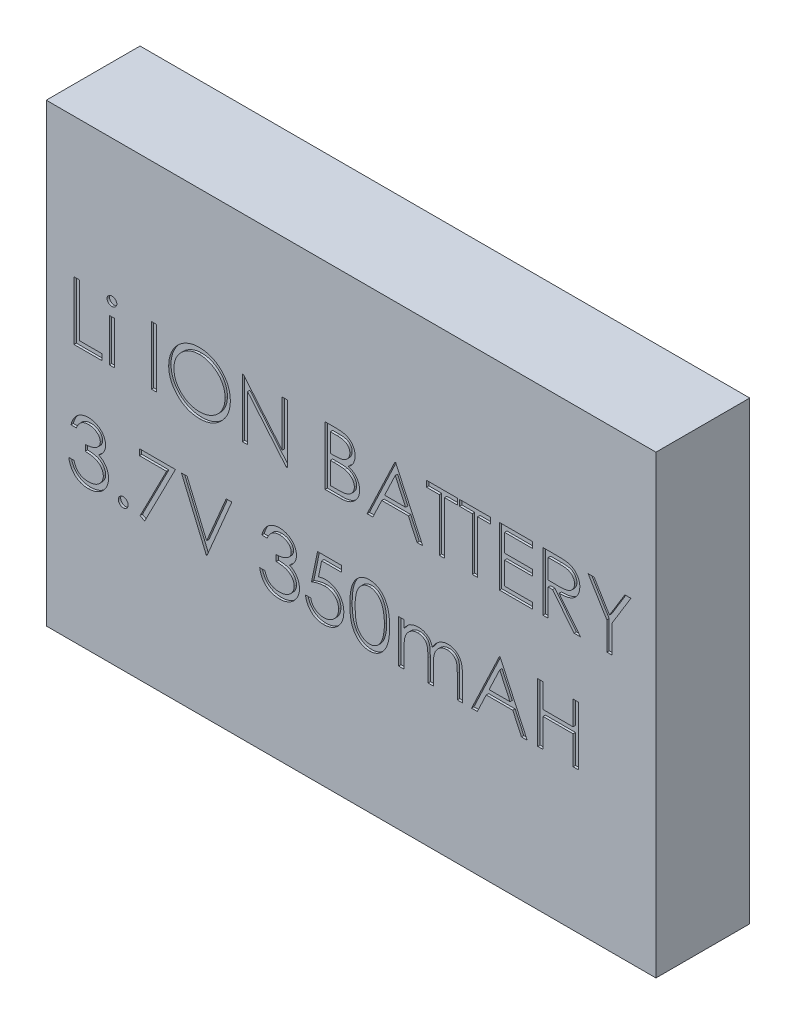
from build123d import *

# Parameters (mm, degrees)
SKETCH1_W           = 33.02
SKETCH1_H           = 24.6634
BOSS_EXTRUDE1_DEPTH = 2.54
SKETCH2_W           = 0.284935898
SKETCH2_H           = 2.320192307
SKETCH2_W_2         = 0.284935897
SKETCH2_H_2         = 3.175
CUT_EXTRUDE1_DEPTH  = 0.127


with BuildPart() as part:
    # Sketch1 → Boss-Extrude1 (new, symmetric)
    with BuildSketch(Plane.XY):
        Rectangle(SKETCH1_W, SKETCH1_H)
    extrude(amount=BOSS_EXTRUDE1_DEPTH, both=True)

    # Sketch2 → Cut-Extrude1 (cut)
    # profile 1 of 23: a face of its own
    with BuildSketch(Plane.XY.offset(2.54)):
        Polygon((-15.007891009, 4.798764989), (-14.722955112, 4.798764989), (-14.722955112, 1.949406014), (-13.501801266, 1.949406014), (-13.501801266, 1.623764989), (-15.007891009, 1.623764989), align=None)
    # profile 2 of 23: a face of its own
    with BuildSketch(Plane.XY.offset(2.54)):
        with BuildLine():
            add(Edge.make_bspline(
                [(-12.95355407, 4.920880373), (-12.935872662, 4.920060178), (-12.90124907, 4.918454078), (-12.851180891, 4.904700452), (-12.805590602, 4.881387166), (-12.76515223, 4.85010917), (-12.730452304, 4.813325032), (-12.706158374, 4.770452582), (-12.690544272, 4.724135102), (-12.688658725, 4.691827129), (-12.687698702, 4.675377569)],
                knots=[0, 0, 0, 0, 1.055194115, 2.066272739, 3.074728998, 4.095836921, 5.109056067, 6.073838105, 7.019297344, 8, 8, 8, 8], degree=3))
            add(Edge.make_bspline(
                [(-12.687698702, 4.675377569), (-12.688680375, 4.659355019), (-12.690621028, 4.627680335), (-12.706146313, 4.582165828), (-12.730659343, 4.539889085), (-12.765129979, 4.503176369), (-12.805596498, 4.471915664), (-12.851179325, 4.448597794), (-12.901249482, 4.434845383), (-12.935872802, 4.433239116), (-12.95355407, 4.432418835)],
                knots=[0, 0, 0, 0, 0.96129708, 1.900370562, 2.859976407, 3.87933698, 4.906634145, 5.921202961, 6.938410037, 8, 8, 8, 8], degree=3))
            add(Edge.make_bspline(
                [(-12.95355407, 4.432418835), (-12.971033148, 4.433207795), (-13.00505389, 4.434743404), (-13.054372383, 4.448867634), (-13.099573941, 4.471923643), (-13.14009118, 4.502971683), (-13.173864284, 4.540114554), (-13.198446336, 4.582140027), (-13.213935766, 4.627686903), (-13.21588125, 4.659357226), (-13.216865368, 4.675377569)],
                knots=[0, 0, 0, 0, 1.054934014, 2.053291228, 3.073705704, 4.106921865, 5.123545215, 6.088680038, 7.033164197, 8, 8, 8, 8], degree=3))
            add(Edge.make_bspline(
                [(-13.216865368, 4.675377569), (-13.215902811, 4.691824839), (-13.214012288, 4.724128317), (-13.198434726, 4.770478811), (-13.174069043, 4.813097745), (-13.140068817, 4.850313734), (-13.099579893, 4.881379235), (-13.054370845, 4.904430625), (-13.005054297, 4.918556055), (-12.971033286, 4.920091498), (-12.95355407, 4.920880373)],
                knots=[0, 0, 0, 0, 0.98631895, 1.937192651, 2.907499808, 3.917963147, 4.944918757, 5.95915025, 6.951458133, 8, 8, 8, 8], degree=3))
        make_face()
    # profile 3 of 23: a face of its own
    with BuildSketch(Plane.XY.offset(2.54)):
        with Locations((-12.952282035, 2.783861143)):
            Rectangle(SKETCH2_W, SKETCH2_H)
    # profile 4 of 23: a face of its own
    with BuildSketch(Plane.XY.offset(2.54)):
        with Locations((-10.672794856, 3.211264989)):
            Rectangle(SKETCH2_W_2, SKETCH2_H_2)
    # profile 5 of 23: a face of its own
    with BuildSketch(Plane.XY.offset(2.54)):
        with BuildLine():
            add(Edge.make_bspline(
                [(-8.230487163, 4.880175245), (-8.171696953, 4.878686189), (-8.056228129, 4.875761559), (-7.886524472, 4.853374087), (-7.724513207, 4.814643269), (-7.568874581, 4.76306042), (-7.421470238, 4.694249656), (-7.281190671, 4.611078129), (-7.14836965, 4.512674484), (-7.024797397, 4.3997994), (-6.911715735, 4.276987267), (-6.812087967, 4.145925163), (-6.728592457, 4.007405535), (-6.66002535, 3.861844638), (-6.60623304, 3.709571668), (-6.569113622, 3.549774822), (-6.545402586, 3.383489468), (-6.542630559, 3.27007224), (-6.541224343, 3.212537024)],
                knots=[0, 0, 0, 0, 1.065120563, 2.091984664, 3.0946048, 4.079830382, 5.057816894, 6.036188127, 7.030412546, 8.04752943, 9.064399622, 10.05169764, 11.02544977, 11.989514704, 12.962713494, 13.945757189, 14.957906945, 16, 16, 16, 16], degree=3))
            add(Edge.make_bspline(
                [(-6.541224343, 3.212537024), (-6.542630353, 3.155425626), (-6.545401762, 3.042852445), (-6.569140582, 2.87762232), (-6.606370632, 2.718790046), (-6.659525816, 2.566620775), (-6.727766071, 2.420953985), (-6.811817548, 2.282172962), (-6.910824218, 2.15023221), (-7.023497575, 2.02657715), (-7.146325664, 1.913186587), (-7.278070263, 1.814381607), (-7.415768489, 1.729360437), (-7.561192295, 1.661520961), (-7.712413043, 1.60729929), (-7.87078415, 1.570330833), (-8.035563524, 1.54648473), (-8.147932221, 1.543746504), (-8.205046458, 1.542354732)],
                knots=[0, 0, 0, 0, 1.043624062, 2.057103931, 3.04512605, 4.022047818, 4.998200453, 5.980619268, 6.982898556, 8.009068085, 9.034988726, 10.034168286, 11.015286542, 11.987931943, 12.962482838, 13.94673481, 14.956375938, 16, 16, 16, 16], degree=3))
            add(Edge.make_bspline(
                [(-8.205046458, 1.542354732), (-8.262581376, 1.543760247), (-8.375998015, 1.546530892), (-8.542492325, 1.570281166), (-8.702401422, 1.607420778), (-8.855268012, 1.660497195), (-9.001177341, 1.729092826), (-9.140414773, 1.812735369), (-9.272421428, 1.911983276), (-9.396102869, 2.024620097), (-9.509268213, 2.147240005), (-9.607928504, 2.278625365), (-9.691589857, 2.416198529), (-9.759955166, 2.560341283), (-9.814079354, 2.710356806), (-9.851004439, 2.867245782), (-9.87489491, 3.030113763), (-9.877647949, 3.141005535), (-9.879044856, 3.197272601)],
                knots=[0, 0, 0, 0, 1.053102029, 2.075944431, 3.073151272, 4.055350789, 5.033113405, 6.020478099, 7.024410459, 8.052272461, 9.079885166, 10.07527673, 11.055994387, 12.023226415, 12.992069828, 13.970394897, 14.97016774, 16, 16, 16, 16], degree=3))
            add(Edge.make_bspline(
                [(-9.879044856, 3.197272601), (-9.878559865, 3.235039379), (-9.877596002, 3.310096491), (-9.865992109, 3.42155405), (-9.849153994, 3.531219147), (-9.825022259, 3.638779935), (-9.793461247, 3.743973114), (-9.756221194, 3.847524163), (-9.710737191, 3.948383684), (-9.659319746, 4.047029475), (-9.601932249, 4.14192379), (-9.538544962, 4.231621697), (-9.471384306, 4.316875887), (-9.397757514, 4.395477098), (-9.320091167, 4.469711915), (-9.237125352, 4.538439522), (-9.149366316, 4.602279656), (-9.056436443, 4.659810966), (-8.96062558, 4.711843895), (-8.861858788, 4.756495146), (-8.76147747, 4.794818359), (-8.659011468, 4.825879679), (-8.554732882, 4.850401597), (-8.44841412, 4.867099696), (-8.340139883, 4.878733185), (-8.26719533, 4.87969249), (-8.230487163, 4.880175245)],
                knots=[0, 0, 0, 0, 1.037015668, 2.060948919, 3.074880161, 4.083647147, 5.086022904, 6.090072063, 7.104153813, 8.122640571, 9.144368836, 10.147691507, 11.138137339, 12.123020368, 13.103399296, 14.087645067, 15.080126199, 16.082011238, 17.087798457, 18.072939717, 19.057185487, 20.037253025, 21.01195951, 21.997135196, 22.992090687, 24, 24, 24, 24], degree=3))
        make_face()
        with BuildLine():
            add(Edge.make_bspline(
                [(-8.216494775, 4.554534219), (-8.246625193, 4.554166926), (-8.306597979, 4.553435851), (-8.395756094, 4.54380588), (-8.483741634, 4.53008091), (-8.57057277, 4.510503387), (-8.65588619, 4.483829711), (-8.740477117, 4.453131173), (-8.823574173, 4.415737755), (-8.90490303, 4.373489659), (-8.983747419, 4.326727423), (-9.058144656, 4.275045892), (-9.12828734, 4.21965706), (-9.194003732, 4.160431665), (-9.255100866, 4.097068098), (-9.312781274, 4.030526959), (-9.364732966, 3.958906315), (-9.412344882, 3.884148303), (-9.454951423, 3.806350297), (-9.492838566, 3.726331351), (-9.523830203, 3.643438735), (-9.549105358, 3.558571749), (-9.570060187, 3.471864804), (-9.583335247, 3.382660141), (-9.59307103, 3.291406003), (-9.593760318, 3.22973675), (-9.594108958, 3.198544636)],
                knots=[0, 0, 0, 0, 1.008559885, 2.007477868, 2.99961109, 3.989939068, 4.984837346, 5.991145699, 7.001802488, 8.033829008, 9.059044045, 10.069351652, 11.065060232, 12.050310815, 13.029377138, 14.011219647, 14.996725999, 15.989392538, 16.977580475, 17.965360261, 18.951710183, 19.937753436, 20.929683414, 21.935841486, 22.955955122, 24, 24, 24, 24], degree=3))
            add(Edge.make_bspline(
                [(-9.594108958, 3.198544636), (-9.592952476, 3.152677479), (-9.590677318, 3.06244259), (-9.570758666, 2.93021006), (-9.540077303, 2.803129972), (-9.494849549, 2.681897668), (-9.438288634, 2.565471069), (-9.368414241, 2.454883002), (-9.285629214, 2.350103581), (-9.191591586, 2.251864301), (-9.088791702, 2.162197036), (-8.979632726, 2.083490229), (-8.865284096, 2.016896645), (-8.745447619, 1.962644901), (-8.620763066, 1.919655639), (-8.490427002, 1.890192881), (-8.355307656, 1.870802289), (-8.263204848, 1.868940146), (-8.216494775, 1.867995758)],
                knots=[0, 0, 0, 0, 1.032063989, 2.030389145, 3.003944642, 3.970395727, 4.937377036, 5.913328081, 6.909231446, 7.93887556, 8.970685674, 9.976071282, 10.964166581, 11.944589148, 12.933237628, 13.927779006, 14.949070134, 16, 16, 16, 16], degree=3))
            add(Edge.make_bspline(
                [(-8.216494775, 1.867995758), (-8.185099013, 1.868427108), (-8.122831787, 1.869282606), (-8.030216564, 1.877899262), (-7.939269857, 1.891716744), (-7.850119232, 1.911610982), (-7.762865867, 1.936509519), (-7.677145582, 1.966089386), (-7.593871418, 2.00299305), (-7.511992851, 2.043767263), (-7.433619118, 2.090249406), (-7.358802027, 2.14017687), (-7.289427389, 2.195484119), (-7.22376016, 2.253829563), (-7.162412185, 2.316389625), (-7.10579832, 2.383082969), (-7.0541092, 2.454330565), (-7.006515364, 2.528975183), (-6.964058118, 2.60698607), (-6.92706565, 2.687295135), (-6.895682031, 2.769704627), (-6.870346887, 2.85433341), (-6.850493647, 2.941020751), (-6.836814005, 3.029882722), (-6.827245064, 3.120741554), (-6.826523816, 3.182194909), (-6.82616024, 3.213173041)],
                knots=[0, 0, 0, 0, 1.047197238, 2.076906641, 3.100256066, 4.114471768, 5.12198147, 6.126382909, 7.136867548, 8.15857795, 9.17633901, 10.174870724, 11.156907918, 12.133735059, 13.104061851, 14.077631395, 15.04955518, 16.038496417, 17.029181396, 18.010275684, 18.986308667, 19.968651475, 20.955262928, 21.950658345, 22.966943676, 24, 24, 24, 24], degree=3))
            add(Edge.make_bspline(
                [(-6.82616024, 3.213173041), (-6.826524107, 3.243939249), (-6.827245904, 3.304969689), (-6.836809434, 3.39519486), (-6.850508099, 3.483417416), (-6.870249984, 3.569291008), (-6.895695481, 3.652837528), (-6.927071131, 3.733978506), (-6.964069224, 3.813016226), (-7.00653097, 3.889755338), (-7.054261038, 3.963392422), (-7.106416531, 4.033788896), (-7.163897954, 4.09962274), (-7.22506299, 4.162519212), (-7.291439436, 4.221136869), (-7.362726617, 4.275495156), (-7.438059097, 4.326905912), (-7.51782166, 4.3732841), (-7.60013939, 4.416114154), (-7.684607051, 4.452808993), (-7.770267735, 4.483989415), (-7.856903608, 4.510584091), (-7.945243881, 4.530004232), (-8.03469164, 4.543818249), (-8.125123132, 4.553432499), (-8.18594091, 4.554165814), (-8.216494775, 4.554534219)],
                knots=[0, 0, 0, 0, 1.02996197, 2.043119294, 3.035359645, 4.018872909, 4.991431989, 5.957985074, 6.929999688, 7.912076566, 8.892894881, 9.867085534, 10.843653904, 11.817741046, 12.803660682, 13.806313499, 14.818574707, 15.856120519, 16.894564902, 17.924820532, 18.937903209, 19.946497019, 20.957711757, 21.963978472, 22.977135795, 24, 24, 24, 24], degree=3))
        make_face(mode=Mode.SUBTRACT)
    # profile 6 of 23: a face of its own
    with BuildSketch(Plane.XY.offset(2.54)):
        Polygon((-5.889942291, 1.623764989), (-5.889942291, 4.798764989), (-5.830156634, 4.798764989), (-3.732570497, 2.299851727), (-3.732570497, 4.798764989), (-3.447634599, 4.798764989), (-3.447634599, 1.623764989), (-3.512508397, 1.623764989), (-5.605006394, 4.116954091), (-5.605006394, 1.623764989), align=None)
    # profile 7 of 23: a face of its own
    with BuildSketch(Plane.XY.offset(2.54)):
        with BuildLine():
            Line((-1.412378189, 4.798764989), (-0.792897019, 4.798764989))
            add(Edge.make_bspline(
                [(-0.792897019, 4.798764989), (-0.762572614, 4.798605558), (-0.703796369, 4.798296541), (-0.618325876, 4.793503987), (-0.538271598, 4.786969229), (-0.463610318, 4.776600502), (-0.394376538, 4.76408939), (-0.33036161, 4.748938457), (-0.271769097, 4.730771457), (-0.201816829, 4.701882331), (-0.122060229, 4.658953457), (-0.035701687, 4.595518258), (0.038143587, 4.517928095), (0.101812603, 4.430404544), (0.15243219, 4.334124236), (0.18905291, 4.231381972), (0.212237554, 4.123502964), (0.214621919, 4.049440938), (0.215826939, 4.012011182)],
                knots=[0, 0, 0, 0, 1.001505555, 1.941167018, 2.826882275, 3.653841531, 4.429895133, 5.150066043, 5.825578002, 6.45369114, 7.647487171, 8.808567382, 9.977351308, 11.170798116, 12.373658725, 13.556498008, 14.765093433, 16, 16, 16, 16], degree=3))
            add(Edge.make_bspline(
                [(0.215826939, 4.012011182), (0.214835234, 3.976947793), (0.21288644, 3.908044925), (0.194251222, 3.807266697), (0.165076902, 3.711335235), (0.124522854, 3.620600642), (0.071816043, 3.537113007), (0.009351711, 3.460198845), (-0.066010817, 3.393114671), (-0.122474327, 3.355610753), (-0.151155232, 3.336560461)],
                knots=[0, 0, 0, 0, 1.044552857, 2.05264487, 3.044412934, 4.028983338, 5.005914585, 5.980388656, 6.974128949, 8, 8, 8, 8], degree=3))
            add(Edge.make_bspline(
                [(-0.151155232, 3.336560461), (-0.115086844, 3.322712927), (-0.046079083, 3.296219162), (0.048886085, 3.24937842), (0.130705694, 3.198431363), (0.20000882, 3.142794613), (0.259279407, 3.082824477), (0.311034575, 3.017641624), (0.355195536, 2.946395751), (0.393035117, 2.869829686), (0.422561488, 2.788725247), (0.444673916, 2.703843186), (0.457344387, 2.615487875), (0.459147462, 2.555357567), (0.460057709, 2.525001968)],
                knots=[0, 0, 0, 0, 1.27268992, 2.434971085, 3.483601985, 4.442670788, 5.356604649, 6.2567628, 7.179492994, 8.113709626, 9.066344395, 10.018646069, 10.999752585, 12, 12, 12, 12], degree=3))
            add(Edge.make_bspline(
                [(0.460057709, 2.525001968), (0.45917157, 2.494007734), (0.457428067, 2.43302571), (0.444564806, 2.343440695), (0.422785117, 2.257829136), (0.392784862, 2.175637292), (0.353630477, 2.09702417), (0.305980109, 2.021900709), (0.249164334, 1.951021709), (0.185607303, 1.883599565), (0.113705213, 1.822977216), (0.036130207, 1.768987967), (-0.048094669, 1.724586897), (-0.13758612, 1.687288791), (-0.233348036, 1.658797976), (-0.334950401, 1.638865712), (-0.442305589, 1.625435429), (-0.515974435, 1.62433125), (-0.553754391, 1.623764989)],
                knots=[0, 0, 0, 0, 0.978564426, 1.925352924, 2.850884081, 3.763762016, 4.682927383, 5.618979971, 6.567305752, 7.547517671, 8.540179244, 9.531824382, 10.526200242, 11.540722885, 12.589160233, 13.674978461, 14.80764778, 16, 16, 16, 16], degree=3))
            Line((-0.553754391, 1.623764989), (-1.412378189, 1.623764989))
            Line((-1.412378189, 1.623764989), (-1.412378189, 4.798764989))
        make_face()
        with BuildLine():
            Line((-1.127442291, 4.473123963), (-1.127442291, 3.455495758))
            Line((-1.127442291, 3.455495758), (-0.936000985, 3.455495758))
            add(Edge.make_bspline(
                [(-0.936000985, 3.455495758), (-0.908016721, 3.455858545), (-0.853945419, 3.456559524), (-0.775640942, 3.4585675), (-0.702956104, 3.464190011), (-0.63601637, 3.469810906), (-0.574927153, 3.478949996), (-0.519823792, 3.489828565), (-0.469841494, 3.501333772), (-0.412202049, 3.520900378), (-0.346821589, 3.549817983), (-0.277122987, 3.594696006), (-0.215678147, 3.648148812), (-0.163792126, 3.709826327), (-0.121327435, 3.777740653), (-0.091832851, 3.85080818), (-0.071832814, 3.927207871), (-0.070026211, 3.979657286), (-0.069108958, 4.006287024)],
                knots=[0, 0, 0, 0, 1.156816544, 2.235205308, 3.236616184, 4.169592532, 5.011045266, 5.787822928, 6.49130361, 7.128639758, 8.301311294, 9.436451833, 10.541879658, 11.654887649, 12.756523258, 13.837046038, 14.901820046, 16, 16, 16, 16], degree=3))
            add(Edge.make_bspline(
                [(-0.069108958, 4.006287024), (-0.069586279, 4.023908974), (-0.070522595, 4.058476353), (-0.078190948, 4.108867553), (-0.091224391, 4.156260099), (-0.107965071, 4.201303471), (-0.131359096, 4.242589221), (-0.158903095, 4.281544834), (-0.192182257, 4.316843684), (-0.230062104, 4.349836015), (-0.273612784, 4.379086408), (-0.322808313, 4.404704815), (-0.378314277, 4.425333948), (-0.439195224, 4.443400743), (-0.506388282, 4.456090124), (-0.579118055, 4.466661411), (-0.657980265, 4.472043256), (-0.712540465, 4.472755692), (-0.740743573, 4.473123963)],
                knots=[0, 0, 0, 0, 0.91205012, 1.789085906, 2.630437955, 3.453916878, 4.269457761, 5.079663411, 5.91843418, 6.774407191, 7.675494373, 8.627863946, 9.638891023, 10.736472738, 11.911756761, 13.175263542, 14.539845004, 16, 16, 16, 16], degree=3))
            Line((-0.740743573, 4.473123963), (-1.127442291, 4.473123963))
        make_face(mode=Mode.SUBTRACT)
        with BuildLine():
            Line((-1.127442291, 3.129854732), (-1.127442291, 1.949406014))
            Line((-1.127442291, 1.949406014), (-0.721663045, 1.949406014))
            add(Edge.make_bspline(
                [(-0.721663045, 1.949406014), (-0.692617305, 1.949754128), (-0.63663547, 1.950425071), (-0.555807926, 1.952615417), (-0.480893253, 1.957597696), (-0.412233301, 1.965440717), (-0.349086676, 1.97394831), (-0.292210903, 1.985388543), (-0.241144935, 1.998495814), (-0.181931813, 2.018756099), (-0.11525363, 2.050230755), (-0.043398067, 2.097687232), (0.020488573, 2.154223375), (0.074740487, 2.219656419), (0.11920227, 2.290804837), (0.151546861, 2.366229547), (0.171495709, 2.444684276), (0.173910677, 2.498175508), (0.175121811, 2.525001968)],
                knots=[0, 0, 0, 0, 1.160039823, 2.235823828, 3.228722157, 4.157150951, 4.99529583, 5.772374946, 6.472645482, 7.099169577, 8.269452708, 9.405989375, 10.527446681, 11.663510218, 12.788923519, 13.866172445, 14.929861265, 16, 16, 16, 16], degree=3))
            add(Edge.make_bspline(
                [(0.175121811, 2.525001968), (0.174871345, 2.541778069), (0.174374453, 2.575059673), (0.166880895, 2.623969023), (0.155982599, 2.671345351), (0.14189337, 2.717317301), (0.121374282, 2.761053721), (0.097419773, 2.803419615), (0.069333359, 2.844470985), (0.025569008, 2.896370672), (-0.038087006, 2.95616682), (-0.128535296, 3.014711554), (-0.231380166, 3.06192635), (-0.305972249, 3.081973733), (-0.344504591, 3.092329692)],
                knots=[0, 0, 0, 0, 0.723448775, 1.435228256, 2.130040452, 2.821711965, 3.505591119, 4.210454504, 4.921174351, 5.648778258, 7.137944449, 8.670945889, 10.280296675, 12, 12, 12, 12], degree=3))
            add(Edge.make_bspline(
                [(-0.344504591, 3.092329692), (-0.359952414, 3.095463947), (-0.39344648, 3.102259658), (-0.448063356, 3.109433074), (-0.510416609, 3.11582395), (-0.580650219, 3.120551214), (-0.658853046, 3.125437579), (-0.745192108, 3.127337881), (-0.839314815, 3.129605067), (-0.904622181, 3.129769382), (-0.938545056, 3.129854732)],
                knots=[0, 0, 0, 0, 0.634451884, 1.375622551, 2.216452059, 3.157844607, 4.20941857, 5.370758133, 6.634282058, 8, 8, 8, 8], degree=3))
            Line((-0.938545056, 3.129854732), (-1.127442291, 3.129854732))
        make_face(mode=Mode.SUBTRACT)
    # profile 8 of 23: a face of its own
    with BuildSketch(Plane.XY.offset(2.54)):
        Polygon((2.413903862, 4.798764989), (3.879288478, 1.623764989), (3.569547893, 1.623764989), (3.100166883, 2.641393194), (1.660858991, 2.641393194), (1.178757628, 1.623764989), (0.867108991, 1.623764989), (2.373198734, 4.798764989), align=None)
        Polygon((2.39037121, 4.179283819), (1.816047292, 2.967034219), (2.950066723, 2.967034219), align=None, mode=Mode.SUBTRACT)
    # profile 9 of 23: a face of its own
    with BuildSketch(Plane.XY.offset(2.54)):
        Polygon((4.082814119, 4.473123963), (4.082814119, 4.798764989), (5.751724375, 4.798764989), (5.751724375, 4.473123963), (5.059737196, 4.473123963), (5.059737196, 1.623764989), (4.774801298, 1.623764989), (4.774801298, 4.473123963), align=None)
    # profile 10 of 23: a face of its own
    with BuildSketch(Plane.XY.offset(2.54)):
        Polygon((5.87383976, 4.473123963), (5.87383976, 4.798764989), (7.542750016, 4.798764989), (7.542750016, 4.473123963), (6.850762837, 4.473123963), (6.850762837, 1.623764989), (6.565826939, 1.623764989), (6.565826939, 4.473123963), align=None)
    # profile 11 of 23: a face of its own
    with BuildSketch(Plane.XY.offset(2.54)):
        Polygon((8.031211555, 4.798764989), (9.822237196, 4.798764989), (9.822237196, 4.473123963), (8.316147452, 4.473123963), (8.316147452, 3.496200886), (9.822237196, 3.496200886), (9.822237196, 3.17055986), (8.316147452, 3.17055986), (8.316147452, 1.949406014), (9.822237196, 1.949406014), (9.822237196, 1.623764989), (8.031211555, 1.623764989), align=None)
    # profile 12 of 23: a face of its own
    with BuildSketch(Plane.XY.offset(2.54)):
        with BuildLine():
            Line((10.392108991, 4.798764989), (11.027490601, 4.798764989))
            add(Edge.make_bspline(
                [(11.027490601, 4.798764989), (11.069891482, 4.79862385), (11.15130587, 4.798352848), (11.267940194, 4.796841763), (11.373919061, 4.79251074), (11.469187058, 4.788783668), (11.553742438, 4.781987407), (11.62784448, 4.775491677), (11.691151891, 4.766988428), (11.729474913, 4.759091365), (11.746826539, 4.75551579)],
                knots=[0, 0, 0, 0, 1.410062039, 2.707475311, 3.878576406, 4.937260626, 5.877586885, 6.699081471, 7.410979367, 8, 8, 8, 8], degree=3))
            add(Edge.make_bspline(
                [(11.746826539, 4.75551579), (11.770055405, 4.74977651), (11.816017602, 4.738420384), (11.882193734, 4.714417746), (11.945253156, 4.686641373), (12.004933925, 4.654017141), (12.060937107, 4.616302876), (12.113840147, 4.574149651), (12.163883103, 4.527788114), (12.209042153, 4.476049365), (12.251622578, 4.421769103), (12.287535118, 4.363073552), (12.31849271, 4.30169488), (12.343140251, 4.237008866), (12.362986698, 4.16964283), (12.376980501, 4.098986564), (12.38537265, 4.025361965), (12.386227047, 3.975144434), (12.386660273, 3.949681455)],
                knots=[0, 0, 0, 0, 1.027469482, 2.033020251, 3.019912614, 3.986113645, 4.951240523, 5.91722682, 6.890402269, 7.87763091, 8.8651537, 9.85103654, 10.82876324, 11.815024772, 12.821070561, 13.842952187, 14.906261191, 16, 16, 16, 16], degree=3))
            add(Edge.make_bspline(
                [(12.386660273, 3.949681455), (12.385327682, 3.907376753), (12.382727451, 3.824829322), (12.358483964, 3.705031237), (12.318772407, 3.59328093), (12.264050566, 3.489719108), (12.194364328, 3.396364451), (12.110612553, 3.314367396), (12.012748519, 3.245751189), (11.921644783, 3.198169002), (11.84116833, 3.167695435), (11.774916682, 3.146253881), (11.702647353, 3.129687669), (11.625052771, 3.114846693), (11.541810026, 3.103641941), (11.453118633, 3.095435388), (11.358915338, 3.090306358), (11.294200611, 3.089542539), (11.260909071, 3.089149604)],
                knots=[0, 0, 0, 0, 1.260483769, 2.459530307, 3.627416485, 4.787058657, 5.939039949, 7.08810263, 8.267026773, 9.491475466, 10.141966685, 10.831826277, 11.566392101, 12.351337768, 13.187381173, 14.07005841, 15.007169909, 16, 16, 16, 16], degree=3))
            Line((11.260909071, 3.089149604), (12.427365401, 1.623764989))
            Line((12.427365401, 1.623764989), (12.075011635, 1.623764989))
            Line((12.075011635, 1.623764989), (10.908555305, 3.089149604))
            Line((10.908555305, 3.089149604), (10.677044888, 3.089149604))
            Line((10.677044888, 3.089149604), (10.677044888, 1.623764989))
            Line((10.677044888, 1.623764989), (10.392108991, 1.623764989))
            Line((10.392108991, 1.623764989), (10.392108991, 4.798764989))
        make_face()
        with BuildLine():
            Line((10.677044888, 4.473123963), (10.677044888, 3.41479063))
            Line((10.677044888, 3.41479063), (11.258365, 3.410338506))
            add(Edge.make_bspline(
                [(11.258365, 3.410338506), (11.28550675, 3.410326499), (11.338115191, 3.410303225), (11.41422508, 3.41392615), (11.485091181, 3.418047589), (11.550442435, 3.424351638), (11.610308035, 3.432476075), (11.66465806, 3.442638782), (11.713581229, 3.454478867), (11.770639188, 3.472804628), (11.834353756, 3.501838659), (11.903597295, 3.544080218), (11.962563701, 3.597210776), (12.012382048, 3.657965268), (12.052413746, 3.724763866), (12.080636824, 3.796805858), (12.09854604, 3.872272522), (12.100658363, 3.924141234), (12.101724375, 3.950317473)],
                knots=[0, 0, 0, 0, 1.146690395, 2.22261258, 3.21895312, 4.145990853, 4.996080663, 5.770904154, 6.481378293, 7.121626537, 8.300444488, 9.431385265, 10.535395872, 11.636531494, 12.74115979, 13.810798291, 14.895190096, 16, 16, 16, 16], degree=3))
            add(Edge.make_bspline(
                [(12.101724375, 3.950317473), (12.10063388, 3.975850436), (12.098472915, 4.026447452), (12.080830104, 4.100521028), (12.050994737, 4.170431761), (12.010788135, 4.235895259), (11.961803187, 4.295318319), (11.904364886, 4.346161093), (11.840043744, 4.388115965), (11.7799263, 4.41492601), (11.726192408, 4.431363306), (11.679538359, 4.442930433), (11.626822947, 4.45222363), (11.567790209, 4.459669513), (11.502692159, 4.466069356), (11.431199639, 4.470379898), (11.353786989, 4.472932475), (11.300132273, 4.473058648), (11.272357388, 4.473123963)],
                knots=[0, 0, 0, 0, 1.101028733, 2.181837193, 3.264309656, 4.369019818, 5.486613113, 6.575447106, 7.666700264, 8.788928104, 9.402425223, 10.0903467, 10.862060571, 11.710948788, 12.657782767, 13.684531032, 14.801375019, 16, 16, 16, 16], degree=3))
            Line((11.272357388, 4.473123963), (10.677044888, 4.473123963))
        make_face(mode=Mode.SUBTRACT)
    # profile 13 of 23: a face of its own
    with BuildSketch(Plane.XY.offset(2.54)):
        Polygon((12.834416683, 4.798764989), (13.160693726, 4.798764989), (13.993876819, 3.435779211), (14.82769593, 4.798764989), (15.154608991, 4.798764989), (14.136980786, 3.13303482), (14.136980786, 1.623764989), (13.852044888, 1.623764989), (13.852044888, 3.13303482), align=None)
    # profile 14 of 23: a face of its own
    with BuildSketch(Plane.XY.offset(2.54)):
        with BuildLine():
            Line((-14.885775625, -2.225593986), (-15.170711522, -2.225593986))
            add(Edge.make_bspline(
                [(-15.170711522, -2.225593986), (-15.162992144, -2.19363309), (-15.147901391, -2.131152152), (-15.116425735, -2.041882708), (-15.082136411, -1.957406371), (-15.040962009, -1.879304932), (-14.996050496, -1.806008785), (-14.944594885, -1.739180365), (-14.888969136, -1.677120032), (-14.827442218, -1.622044452), (-14.762918361, -1.572171798), (-14.694488384, -1.529649424), (-14.623529045, -1.493069657), (-14.549548703, -1.462934161), (-14.472327104, -1.440232436), (-14.392562374, -1.42376162), (-14.310045485, -1.413065395), (-14.254031599, -1.412021488), (-14.225589327, -1.411491422)],
                knots=[0, 0, 0, 0, 1.162005537, 2.271625781, 3.343758855, 4.383309926, 5.390229558, 6.379919256, 7.361854164, 8.333198761, 9.295911338, 10.242430842, 11.177959212, 12.116337295, 13.062827104, 14.020064771, 14.994644689, 16, 16, 16, 16], degree=3))
            add(Edge.make_bspline(
                [(-14.225589327, -1.411491422), (-14.184148554, -1.412742581), (-14.102170951, -1.415217607), (-13.981735901, -1.43781856), (-13.865597287, -1.473582787), (-13.755026326, -1.52299824), (-13.652321034, -1.583946731), (-13.560938921, -1.656486171), (-13.482118629, -1.739216966), (-13.415993015, -1.830595792), (-13.364217838, -1.928254718), (-13.326039485, -2.028766289), (-13.30279696, -2.131892078), (-13.29978474, -2.201521895), (-13.298275625, -2.236406285)],
                knots=[0, 0, 0, 0, 1.083050992, 2.142477498, 3.193116406, 4.255571735, 5.30263384, 6.308962982, 7.297363603, 8.282367274, 9.249857812, 10.179914175, 11.08814088, 12, 12, 12, 12], degree=3))
            add(Edge.make_bspline(
                [(-13.298275625, -2.236406285), (-13.299331168, -2.269976735), (-13.301396703, -2.335668895), (-13.318935135, -2.431573396), (-13.348450174, -2.521962562), (-13.389334887, -2.607216902), (-13.442259008, -2.686795864), (-13.50636924, -2.760878493), (-13.582118083, -2.829793373), (-13.63952112, -2.869271752), (-13.669073902, -2.88959639)],
                knots=[0, 0, 0, 0, 1.024540389, 2.004866551, 2.965041327, 3.920577974, 4.882998113, 5.874504559, 6.905732034, 8, 8, 8, 8], degree=3))
            add(Edge.make_bspline(
                [(-13.669073902, -2.88959639), (-13.635299382, -2.90590516), (-13.568382289, -2.93821755), (-13.477168594, -3.001586701), (-13.394366521, -3.074753531), (-13.348189576, -3.131851509), (-13.324988365, -3.160539899)],
                knots=[0, 0, 0, 0, 1.015518401, 2.012035669, 3.001164323, 4, 4, 4, 4], degree=3))
            add(Edge.make_bspline(
                [(-13.324988365, -3.160539899), (-13.309710862, -3.181456574), (-13.279406035, -3.222947398), (-13.241999515, -3.289655442), (-13.208064104, -3.357102864), (-13.181620691, -3.427097468), (-13.161142969, -3.498827988), (-13.146505282, -3.57241759), (-13.137411954, -3.647926367), (-13.136109704, -3.699009832), (-13.135455112, -3.724687535)],
                knots=[0, 0, 0, 0, 1.025084078, 2.033381695, 3.024893161, 4.013698104, 4.991890475, 5.976764909, 6.982997093, 8, 8, 8, 8], degree=3))
            add(Edge.make_bspline(
                [(-13.135455112, -3.724687535), (-13.137082992, -3.769146354), (-13.140331091, -3.857854767), (-13.169363359, -3.988913979), (-13.214369656, -4.117025684), (-13.278284162, -4.23955786), (-13.356178259, -4.35420292), (-13.448849546, -4.456779286), (-13.555245074, -4.544952306), (-13.673904484, -4.618621584), (-13.802462165, -4.677511413), (-13.93996288, -4.718384951), (-14.084425429, -4.745005965), (-14.183492049, -4.747860624), (-14.233857556, -4.749311935)],
                knots=[0, 0, 0, 0, 0.955779014, 1.907060117, 2.875433937, 3.871313158, 4.872415639, 5.851225146, 6.836215519, 7.83643374, 8.849228613, 9.86973379, 10.916971861, 12, 12, 12, 12], degree=3))
            add(Edge.make_bspline(
                [(-14.233857556, -4.749311935), (-14.267802207, -4.748524341), (-14.334593961, -4.74697462), (-14.432786277, -4.73638046), (-14.526513819, -4.717031098), (-14.615903311, -4.6909931), (-14.701034165, -4.657980591), (-14.781646604, -4.616870058), (-14.858236579, -4.568508909), (-14.930081341, -4.512326298), (-14.997172328, -4.449478225), (-15.057726585, -4.37884898), (-15.112753683, -4.301744193), (-15.160780219, -4.217268277), (-15.203993741, -4.126512937), (-15.239536465, -4.028316085), (-15.270819803, -3.923555579), (-15.285364445, -3.850550772), (-15.292826907, -3.813093986)],
                knots=[0, 0, 0, 0, 1.048658725, 2.063410685, 3.046034179, 4.001477787, 4.936774919, 5.862367409, 6.792675028, 7.730719943, 8.675894397, 9.627829632, 10.600096036, 11.597688215, 12.626045268, 13.701542398, 14.82072376, 16, 16, 16, 16], degree=3))
            Line((-15.292826907, -3.813093986), (-15.007891009, -3.813093986))
            add(Edge.make_bspline(
                [(-15.007891009, -3.813093986), (-15.000467595, -3.837540591), (-14.986028409, -3.885091361), (-14.96145001, -3.953526495), (-14.933448078, -4.016262729), (-14.903408442, -4.073760275), (-14.871859424, -4.126585383), (-14.836558027, -4.173341222), (-14.800118874, -4.216081441), (-14.772651175, -4.240161196), (-14.759208117, -4.251946149)],
                knots=[0, 0, 0, 0, 1.198163088, 2.33053128, 3.407730985, 4.417276592, 5.372219308, 6.28897303, 7.162600585, 8, 8, 8, 8], degree=3))
            add(Edge.make_bspline(
                [(-14.759208117, -4.251946149), (-14.741431222, -4.265651566), (-14.705932307, -4.293020095), (-14.648085411, -4.327946573), (-14.587247979, -4.358209788), (-14.52210181, -4.381327141), (-14.454052697, -4.400901162), (-14.38200073, -4.41371049), (-14.306581583, -4.422499045), (-14.255085112, -4.42327459), (-14.228769415, -4.423670909)],
                knots=[0, 0, 0, 0, 0.946170439, 1.889420265, 2.845303464, 3.807233317, 4.801018734, 5.828864929, 6.890507805, 8, 8, 8, 8], degree=3))
            add(Edge.make_bspline(
                [(-14.228769415, -4.423670909), (-14.199057309, -4.423112195), (-14.140957851, -4.422019678), (-14.056180942, -4.411972429), (-13.975529186, -4.39733984), (-13.899898032, -4.374740206), (-13.828296786, -4.346817576), (-13.761729147, -4.311757951), (-13.699321251, -4.270623811), (-13.641872433, -4.223870431), (-13.590214723, -4.172688075), (-13.544731021, -4.119154789), (-13.506064364, -4.063496287), (-13.474873547, -4.005404563), (-13.450244119, -3.945120176), (-13.433477216, -3.882473953), (-13.421819055, -3.817978575), (-13.420869629, -3.774137296), (-13.420391009, -3.752036293)],
                knots=[0, 0, 0, 0, 1.217147791, 2.380027433, 3.494444702, 4.572153297, 5.609568379, 6.639424714, 7.649109417, 8.668170816, 9.669597737, 10.625200337, 11.543417969, 12.441394052, 13.322311151, 14.205496177, 15.095365482, 16, 16, 16, 16], degree=3))
            add(Edge.make_bspline(
                [(-13.420391009, -3.752036293), (-13.421779211, -3.72245315), (-13.424548708, -3.663434066), (-13.44569292, -3.576604552), (-13.480471746, -3.492944742), (-13.529160382, -3.41388199), (-13.588429221, -3.340606708), (-13.657703101, -3.275227577), (-13.73755728, -3.221279709), (-13.811053875, -3.184006428), (-13.876155124, -3.158572795), (-13.931867651, -3.141631934), (-13.994239713, -3.12728669), (-14.062517044, -3.113940558), (-14.137214104, -3.102581906), (-14.218249573, -3.093109688), (-14.305639871, -3.085530472), (-14.366138286, -3.082145835), (-14.397314086, -3.080401678)],
                knots=[0, 0, 0, 0, 1.07054697, 2.135767047, 3.216561865, 4.33974944, 5.486079747, 6.621378074, 7.775625952, 8.963672916, 9.598146892, 10.304877434, 11.070270905, 11.915000392, 12.823868403, 13.805723172, 14.86925407, 16, 16, 16, 16], degree=3))
            Line((-14.397314086, -3.080401678), (-14.397314086, -2.754760652))
            add(Edge.make_bspline(
                [(-14.397314086, -2.754760652), (-14.358033743, -2.754094081), (-14.2810932, -2.75278843), (-14.168703367, -2.736996878), (-14.061231148, -2.715152308), (-13.961058317, -2.681692169), (-13.869755556, -2.6428299), (-13.790544203, -2.597606824), (-13.724534005, -2.54733773), (-13.672045747, -2.49124672), (-13.632558518, -2.431089499), (-13.603687066, -2.368390816), (-13.586632485, -2.302601132), (-13.584355858, -2.257702398), (-13.583211522, -2.23513425)],
                knots=[0, 0, 0, 0, 1.321986639, 2.589447074, 3.816329219, 5.01088745, 6.139805852, 7.153945165, 8.075214402, 8.924034688, 9.728124013, 10.488707548, 11.240355623, 12, 12, 12, 12], degree=3))
            add(Edge.make_bspline(
                [(-13.583211522, -2.23513425), (-13.583587452, -2.218553724), (-13.584335347, -2.185567554), (-13.593767163, -2.137375528), (-13.6079404, -2.090656812), (-13.627425583, -2.045610085), (-13.653506121, -2.002547765), (-13.684717266, -1.961102722), (-13.721881185, -1.921511579), (-13.764467412, -1.884608718), (-13.810198121, -1.849439481), (-13.86031756, -1.819582111), (-13.913314546, -1.794050519), (-13.969247754, -1.772996185), (-14.0282987, -1.757158116), (-14.090189934, -1.745786317), (-14.155039476, -1.738676445), (-14.199282404, -1.73765281), (-14.221773221, -1.737132447)],
                knots=[0, 0, 0, 0, 0.884392785, 1.759457502, 2.611959086, 3.489218968, 4.37281399, 5.2945488, 6.255912374, 7.266815255, 8.301784654, 9.332968512, 10.37626691, 11.440494194, 12.520033166, 13.637162961, 14.798855837, 16, 16, 16, 16], degree=3))
            add(Edge.make_bspline(
                [(-14.221773221, -1.737132447), (-14.257924377, -1.738394611), (-14.328535993, -1.740859911), (-14.430330953, -1.762452645), (-14.524963492, -1.796904192), (-14.597297853, -1.838027717), (-14.65071276, -1.878622753), (-14.688882554, -1.914076061), (-14.72636616, -1.953475837), (-14.760697595, -1.999248792), (-14.79541756, -2.048295094), (-14.827026555, -2.103108005), (-14.857742133, -2.162257706), (-14.87625016, -2.204073031), (-14.885775625, -2.225593986)],
                knots=[0, 0, 0, 0, 1.472543308, 2.876219568, 4.221790263, 5.565193594, 6.249813518, 6.953379497, 7.687249741, 8.463570142, 9.283606569, 10.136032583, 11.040678096, 12, 12, 12, 12], degree=3))
        make_face()
    # profile 15 of 23: a face of its own
    with BuildSketch(Plane.XY.offset(2.54)):
        with BuildLine():
            add(Edge.make_bspline(
                [(-12.341705112, -4.17944014), (-12.324024705, -4.180490762), (-12.289364335, -4.182550385), (-12.239254554, -4.196680653), (-12.193902256, -4.22177101), (-12.153505148, -4.255210816), (-12.12020713, -4.295756167), (-12.09422261, -4.340746742), (-12.080215431, -4.391276044), (-12.078170811, -4.426137249), (-12.077121779, -4.444023473)],
                knots=[0, 0, 0, 0, 1.020151414, 1.999887582, 2.974338812, 3.990962822, 5.007586832, 5.987933904, 6.967670073, 8, 8, 8, 8], degree=3))
            add(Edge.make_bspline(
                [(-12.077121779, -4.444023473), (-12.078206359, -4.461479922), (-12.080345136, -4.495903783), (-12.094190502, -4.546051967), (-12.120405162, -4.591070659), (-12.153275477, -4.63216617), (-12.193912242, -4.665676817), (-12.239361774, -4.690553709), (-12.289246701, -4.705695719), (-12.32400508, -4.707624574), (-12.341705112, -4.708606806)],
                knots=[0, 0, 0, 0, 1.009421747, 1.99056486, 2.972319754, 3.999869655, 5.017953583, 5.993804169, 6.978383603, 8, 8, 8, 8], degree=3))
            add(Edge.make_bspline(
                [(-12.341705112, -4.708606806), (-12.359417898, -4.707660115), (-12.393997896, -4.705811924), (-12.443696619, -4.690242807), (-12.48942294, -4.665910097), (-12.530051793, -4.632103686), (-12.563197407, -4.591282127), (-12.588257575, -4.545741926), (-12.603307211, -4.496047337), (-12.605286481, -4.461508196), (-12.606288445, -4.444023473)],
                knots=[0, 0, 0, 0, 1.022052826, 1.995314843, 2.982371812, 4.00089066, 5.028879526, 6.005146991, 6.990147033, 8, 8, 8, 8], degree=3))
            add(Edge.make_bspline(
                [(-12.606288445, -4.444023473), (-12.60532497, -4.426107964), (-12.603443901, -4.391130132), (-12.588225981, -4.341056656), (-12.563391846, -4.295546715), (-12.529822666, -4.255272674), (-12.489432769, -4.221538478), (-12.443806926, -4.196986845), (-12.3938782, -4.182435899), (-12.359397756, -4.180456045), (-12.341705112, -4.17944014)],
                knots=[0, 0, 0, 0, 1.032775665, 2.016367738, 2.991239715, 4.008302682, 5.025365648, 6.011011707, 6.979408107, 8, 8, 8, 8], degree=3))
        make_face()
    # profile 16 of 23: a face of its own
    with BuildSketch(Plane.XY.offset(2.54)):
        Polygon((-11.466544856, -1.492901678), (-9.512698702, -1.492901678), (-11.181608958, -4.749311935), (-11.42774778, -4.61384018), (-9.995436081, -1.818542704), (-11.466544856, -1.818542704), align=None)
    # profile 17 of 23: a face of its own
    with BuildSketch(Plane.XY.offset(2.54)):
        Polygon((-9.187057676, -1.492901678), (-8.881769214, -1.492901678), (-7.824071899, -3.993086975), (-6.765738565, -1.492901678), (-6.459814086, -1.492901678), (-7.803083317, -4.667901678), (-7.843788445, -4.667901678), align=None)
    # profile 18 of 23: a face of its own
    with BuildSketch(Plane.XY.offset(2.54)):
        with BuildLine():
            Line((-4.546673061, -2.225593986), (-4.831608958, -2.225593986))
            add(Edge.make_bspline(
                [(-4.831608958, -2.225593986), (-4.82388958, -2.19363309), (-4.808798827, -2.131152152), (-4.777323171, -2.041882708), (-4.743033847, -1.957406371), (-4.701859445, -1.879304932), (-4.656947932, -1.806008785), (-4.60549232, -1.739180365), (-4.549866572, -1.677120032), (-4.488339654, -1.622044452), (-4.423815796, -1.572171798), (-4.35538582, -1.529649424), (-4.284426481, -1.493069657), (-4.210446139, -1.462934161), (-4.13322454, -1.440232436), (-4.05345981, -1.42376162), (-3.970942921, -1.413065395), (-3.914929035, -1.412021488), (-3.886486763, -1.411491422)],
                knots=[0, 0, 0, 0, 1.162005537, 2.271625781, 3.343758855, 4.383309926, 5.390229558, 6.379919256, 7.361854164, 8.333198761, 9.295911338, 10.242430842, 11.177959212, 12.116337295, 13.062827104, 14.020064771, 14.994644689, 16, 16, 16, 16], degree=3))
            add(Edge.make_bspline(
                [(-3.886486763, -1.411491422), (-3.845045989, -1.412742581), (-3.763068387, -1.415217607), (-3.642633337, -1.43781856), (-3.526494722, -1.473582787), (-3.415923762, -1.52299824), (-3.313218469, -1.583946731), (-3.221836357, -1.656486171), (-3.143016065, -1.739216966), (-3.076890451, -1.830595792), (-3.025115274, -1.928254718), (-2.98693692, -2.028766289), (-2.963694396, -2.131892078), (-2.960682176, -2.201521895), (-2.959173061, -2.236406285)],
                knots=[0, 0, 0, 0, 1.083050992, 2.142477498, 3.193116406, 4.255571735, 5.30263384, 6.308962982, 7.297363603, 8.282367274, 9.249857812, 10.179914175, 11.08814088, 12, 12, 12, 12], degree=3))
            add(Edge.make_bspline(
                [(-2.959173061, -2.236406285), (-2.960228604, -2.269976735), (-2.962294138, -2.335668895), (-2.979832571, -2.431573396), (-3.00934761, -2.521962562), (-3.050232323, -2.607216902), (-3.103156444, -2.686795864), (-3.167266676, -2.760878493), (-3.243015519, -2.829793373), (-3.300418556, -2.869271752), (-3.329971338, -2.88959639)],
                knots=[0, 0, 0, 0, 1.024540389, 2.004866551, 2.965041327, 3.920577974, 4.882998113, 5.874504559, 6.905732034, 8, 8, 8, 8], degree=3))
            add(Edge.make_bspline(
                [(-3.329971338, -2.88959639), (-3.296196818, -2.90590516), (-3.229279725, -2.93821755), (-3.13806603, -3.001586701), (-3.055263957, -3.074753531), (-3.009087012, -3.131851509), (-2.985885801, -3.160539899)],
                knots=[0, 0, 0, 0, 1.015518401, 2.012035669, 3.001164323, 4, 4, 4, 4], degree=3))
            add(Edge.make_bspline(
                [(-2.985885801, -3.160539899), (-2.970608298, -3.181456574), (-2.94030347, -3.222947398), (-2.902896951, -3.289655442), (-2.86896154, -3.357102864), (-2.842518126, -3.427097468), (-2.822040404, -3.498827988), (-2.807402718, -3.57241759), (-2.79830939, -3.647926367), (-2.797007139, -3.699009832), (-2.796352548, -3.724687535)],
                knots=[0, 0, 0, 0, 1.025084078, 2.033381695, 3.024893161, 4.013698104, 4.991890475, 5.976764909, 6.982997093, 8, 8, 8, 8], degree=3))
            add(Edge.make_bspline(
                [(-2.796352548, -3.724687535), (-2.797980428, -3.769146354), (-2.801228527, -3.857854767), (-2.830260795, -3.988913979), (-2.875267092, -4.117025684), (-2.939181598, -4.23955786), (-3.017075695, -4.35420292), (-3.109746982, -4.456779286), (-3.21614251, -4.544952306), (-3.33480192, -4.618621584), (-3.463359601, -4.677511413), (-3.600860316, -4.718384951), (-3.745322865, -4.745005965), (-3.844389485, -4.747860624), (-3.894754992, -4.749311935)],
                knots=[0, 0, 0, 0, 0.955779014, 1.907060117, 2.875433937, 3.871313158, 4.872415639, 5.851225146, 6.836215519, 7.83643374, 8.849228613, 9.86973379, 10.916971861, 12, 12, 12, 12], degree=3))
            add(Edge.make_bspline(
                [(-3.894754992, -4.749311935), (-3.928699643, -4.748524341), (-3.995491397, -4.74697462), (-4.093683713, -4.73638046), (-4.187411255, -4.717031098), (-4.276800747, -4.6909931), (-4.361931601, -4.657980591), (-4.44254404, -4.616870058), (-4.519134014, -4.568508909), (-4.590978777, -4.512326298), (-4.658069764, -4.449478225), (-4.718624021, -4.37884898), (-4.773651119, -4.301744193), (-4.821677655, -4.217268277), (-4.864891176, -4.126512937), (-4.900433901, -4.028316085), (-4.931717239, -3.923555579), (-4.946261881, -3.850550772), (-4.953724343, -3.813093986)],
                knots=[0, 0, 0, 0, 1.048658725, 2.063410685, 3.046034179, 4.001477787, 4.936774919, 5.862367409, 6.792675028, 7.730719943, 8.675894397, 9.627829632, 10.600096036, 11.597688215, 12.626045268, 13.701542398, 14.82072376, 16, 16, 16, 16], degree=3))
            Line((-4.953724343, -3.813093986), (-4.668788445, -3.813093986))
            add(Edge.make_bspline(
                [(-4.668788445, -3.813093986), (-4.661365031, -3.837540591), (-4.646925845, -3.885091361), (-4.622347446, -3.953526495), (-4.594345514, -4.016262729), (-4.564305878, -4.073760275), (-4.532756859, -4.126585383), (-4.497455463, -4.173341222), (-4.46101631, -4.216081441), (-4.433548611, -4.240161196), (-4.420105553, -4.251946149)],
                knots=[0, 0, 0, 0, 1.198163088, 2.33053128, 3.407730985, 4.417276592, 5.372219308, 6.28897303, 7.162600585, 8, 8, 8, 8], degree=3))
            add(Edge.make_bspline(
                [(-4.420105553, -4.251946149), (-4.402328658, -4.265651566), (-4.366829743, -4.293020095), (-4.308982847, -4.327946573), (-4.248145415, -4.358209788), (-4.182999246, -4.381327141), (-4.114950133, -4.400901162), (-4.042898166, -4.41371049), (-3.967479019, -4.422499045), (-3.915982548, -4.42327459), (-3.889666851, -4.423670909)],
                knots=[0, 0, 0, 0, 0.946170439, 1.889420265, 2.845303464, 3.807233317, 4.801018734, 5.828864929, 6.890507805, 8, 8, 8, 8], degree=3))
            add(Edge.make_bspline(
                [(-3.889666851, -4.423670909), (-3.859954745, -4.423112195), (-3.801855286, -4.422019678), (-3.717078378, -4.411972429), (-3.636426622, -4.39733984), (-3.560795468, -4.374740206), (-3.489194222, -4.346817576), (-3.422626583, -4.311757951), (-3.360218687, -4.270623811), (-3.302769869, -4.223870431), (-3.251112159, -4.172688075), (-3.205628457, -4.119154789), (-3.1669618, -4.063496287), (-3.135770983, -4.005404563), (-3.111141555, -3.945120176), (-3.094374652, -3.882473953), (-3.082716491, -3.817978575), (-3.081767065, -3.774137296), (-3.081288445, -3.752036293)],
                knots=[0, 0, 0, 0, 1.217147791, 2.380027433, 3.494444702, 4.572153297, 5.609568379, 6.639424714, 7.649109417, 8.668170816, 9.669597737, 10.625200337, 11.543417969, 12.441394052, 13.322311151, 14.205496177, 15.095365482, 16, 16, 16, 16], degree=3))
            add(Edge.make_bspline(
                [(-3.081288445, -3.752036293), (-3.082676647, -3.72245315), (-3.085446144, -3.663434066), (-3.106590355, -3.576604552), (-3.141369182, -3.492944742), (-3.190057817, -3.41388199), (-3.249326657, -3.340606708), (-3.318600537, -3.275227577), (-3.398454715, -3.221279709), (-3.471951311, -3.184006428), (-3.53705256, -3.158572795), (-3.592765087, -3.141631934), (-3.655137149, -3.12728669), (-3.72341448, -3.113940558), (-3.79811154, -3.102581906), (-3.879147009, -3.093109688), (-3.966537307, -3.085530472), (-4.027035722, -3.082145835), (-4.058211522, -3.080401678)],
                knots=[0, 0, 0, 0, 1.07054697, 2.135767047, 3.216561865, 4.33974944, 5.486079747, 6.621378074, 7.775625952, 8.963672916, 9.598146892, 10.304877434, 11.070270905, 11.915000392, 12.823868403, 13.805723172, 14.86925407, 16, 16, 16, 16], degree=3))
            Line((-4.058211522, -3.080401678), (-4.058211522, -2.754760652))
            add(Edge.make_bspline(
                [(-4.058211522, -2.754760652), (-4.018931179, -2.754094081), (-3.941990636, -2.75278843), (-3.829600802, -2.736996878), (-3.722128584, -2.715152308), (-3.621955753, -2.681692169), (-3.530652992, -2.6428299), (-3.451441639, -2.597606824), (-3.385431441, -2.54733773), (-3.332943183, -2.49124672), (-3.293455954, -2.431089499), (-3.264584502, -2.368390816), (-3.247529921, -2.302601132), (-3.245253294, -2.257702398), (-3.244108958, -2.23513425)],
                knots=[0, 0, 0, 0, 1.321986639, 2.589447074, 3.816329219, 5.01088745, 6.139805852, 7.153945165, 8.075214402, 8.924034688, 9.728124013, 10.488707548, 11.240355623, 12, 12, 12, 12], degree=3))
            add(Edge.make_bspline(
                [(-3.244108958, -2.23513425), (-3.244484888, -2.218553724), (-3.245232783, -2.185567554), (-3.254664599, -2.137375528), (-3.268837836, -2.090656812), (-3.288323019, -2.045610085), (-3.314403557, -2.002547765), (-3.345614702, -1.961102722), (-3.382778621, -1.921511579), (-3.425364848, -1.884608718), (-3.471095557, -1.849439481), (-3.521214996, -1.819582111), (-3.574211982, -1.794050519), (-3.63014519, -1.772996185), (-3.689196136, -1.757158116), (-3.75108737, -1.745786317), (-3.815936912, -1.738676445), (-3.86017984, -1.73765281), (-3.882670657, -1.737132447)],
                knots=[0, 0, 0, 0, 0.884392785, 1.759457502, 2.611959086, 3.489218968, 4.37281399, 5.2945488, 6.255912374, 7.266815255, 8.301784654, 9.332968512, 10.37626691, 11.440494194, 12.520033166, 13.637162961, 14.798855837, 16, 16, 16, 16], degree=3))
            add(Edge.make_bspline(
                [(-3.882670657, -1.737132447), (-3.918821813, -1.738394611), (-3.989433429, -1.740859911), (-4.091228389, -1.762452645), (-4.185860928, -1.796904192), (-4.258195289, -1.838027717), (-4.311610196, -1.878622753), (-4.34977999, -1.914076061), (-4.387263596, -1.953475837), (-4.421595031, -1.999248792), (-4.456314996, -2.048295094), (-4.487923991, -2.103108005), (-4.518639569, -2.162257706), (-4.537147596, -2.204073031), (-4.546673061, -2.225593986)],
                knots=[0, 0, 0, 0, 1.472543308, 2.876219568, 4.221790263, 5.565193594, 6.249813518, 6.953379497, 7.687249741, 8.463570142, 9.283606569, 10.136032583, 11.040678096, 12, 12, 12, 12], degree=3))
        make_face()
    # profile 19 of 23: a face of its own
    with BuildSketch(Plane.XY.offset(2.54)):
        with BuildLine():
            Line((-0.516865368, -1.492901678), (-0.516865368, -1.818542704))
            Line((-0.516865368, -1.818542704), (-1.596187283, -1.818542704))
            Line((-1.596187283, -1.818542704), (-1.767912043, -2.65363385))
            add(Edge.make_bspline(
                [(-1.767912043, -2.65363385), (-1.734297071, -2.644353532), (-1.66917338, -2.626374383), (-1.573052649, -2.606412006), (-1.48180115, -2.594378353), (-1.422587064, -2.592735236), (-1.393933678, -2.59194014)],
                knots=[0, 0, 0, 0, 1.100273476, 2.13160584, 3.095893838, 4, 4, 4, 4], degree=3))
            add(Edge.make_bspline(
                [(-1.393933678, -2.59194014), (-1.358479142, -2.592707524), (-1.288766668, -2.594216394), (-1.18676848, -2.608705143), (-1.089402213, -2.631510637), (-0.996871491, -2.663369967), (-0.909005134, -2.704109511), (-0.826611561, -2.755000171), (-0.748454025, -2.814448265), (-0.675934672, -2.882796954), (-0.610144764, -2.958018706), (-0.552299902, -3.038897632), (-0.503166695, -3.124647726), (-0.463650868, -3.216088278), (-0.432096507, -3.312208367), (-0.41109434, -3.414019353), (-0.397109183, -3.520561576), (-0.395546733, -3.593409293), (-0.394749984, -3.630556927)],
                knots=[0, 0, 0, 0, 1.052922333, 2.070308379, 3.05430497, 4.020497103, 4.973039431, 5.925935799, 6.892292201, 7.88610001, 8.88166317, 9.857072816, 10.836096531, 11.812156883, 12.81219415, 13.836441305, 14.89672472, 16, 16, 16, 16], degree=3))
            add(Edge.make_bspline(
                [(-0.394749984, -3.630556927), (-0.395353302, -3.656430655), (-0.396551785, -3.707828451), (-0.402646504, -3.784159261), (-0.414381046, -3.858874117), (-0.430136053, -3.93198293), (-0.450585247, -4.003347289), (-0.475340317, -4.073171461), (-0.505635285, -4.141020854), (-0.538865175, -4.207537462), (-0.576281623, -4.271217537), (-0.617809269, -4.330770546), (-0.661683679, -4.387089858), (-0.70889265, -4.439571459), (-0.759874981, -4.487870482), (-0.814013237, -4.532273566), (-0.870875418, -4.57353163), (-0.931341245, -4.609969922), (-0.994063354, -4.643500603), (-1.059947523, -4.671008383), (-1.127494015, -4.695601505), (-1.19767501, -4.715204434), (-1.27033154, -4.73056468), (-1.345583372, -4.740997368), (-1.423035837, -4.748595993), (-1.475536741, -4.74907166), (-1.502056674, -4.749311935)],
                knots=[0, 0, 0, 0, 1.056347294, 2.098418968, 3.122841568, 4.141288669, 5.149314143, 6.15115421, 7.162517403, 8.180376062, 9.185164535, 10.17417709, 11.141909838, 12.097768115, 13.052685741, 14.0056014, 14.954263652, 15.917497458, 16.885230207, 17.854509472, 18.828990115, 19.81800267, 20.826176721, 21.857883937, 22.917946725, 24, 24, 24, 24], degree=3))
            add(Edge.make_bspline(
                [(-1.502056674, -4.749311935), (-1.533692538, -4.748685246), (-1.595932363, -4.74745231), (-1.687118878, -4.734554112), (-1.774852842, -4.716081131), (-1.858428005, -4.688289658), (-1.938593365, -4.653466898), (-2.014269688, -4.609455799), (-2.087390642, -4.559581898), (-2.154983704, -4.500726149), (-2.217718178, -4.436395495), (-2.273876225, -4.36658392), (-2.323890256, -4.292443641), (-2.366959355, -4.213614601), (-2.403696846, -4.130303933), (-2.432557585, -4.042199497), (-2.455851521, -3.949761636), (-2.465706196, -3.88612238), (-2.470711522, -3.853799114)],
                knots=[0, 0, 0, 0, 1.0467383, 2.05933395, 3.04377827, 4.011590433, 4.970194871, 5.932262533, 6.905835911, 7.896367577, 8.894135286, 9.877477877, 10.858688626, 11.851381753, 12.8477658, 13.868841284, 14.917554742, 16, 16, 16, 16], degree=3))
            Line((-2.470711522, -3.853799114), (-2.185775625, -3.853799114))
            add(Edge.make_bspline(
                [(-2.185775625, -3.853799114), (-2.178764719, -3.884076324), (-2.165289369, -3.942270804), (-2.135711297, -4.024032807), (-2.099547253, -4.096893817), (-2.056544737, -4.161817653), (-2.005245781, -4.218431529), (-1.94670837, -4.268884149), (-1.88107865, -4.31440016), (-1.808150506, -4.352339384), (-1.731212927, -4.384696039), (-1.650688386, -4.406242219), (-1.568769443, -4.421392315), (-1.513362636, -4.422908841), (-1.485520216, -4.423670909)],
                knots=[0, 0, 0, 0, 1.136247022, 2.183929868, 3.172523383, 4.106158343, 5.02341133, 5.958108904, 6.928429099, 7.938127109, 8.96079061, 9.975095812, 10.982467395, 12, 12, 12, 12], degree=3))
            add(Edge.make_bspline(
                [(-1.485520216, -4.423670909), (-1.458343627, -4.422926346), (-1.404832701, -4.421460296), (-1.326082372, -4.410176335), (-1.250052122, -4.392797681), (-1.177492163, -4.366790027), (-1.107132766, -4.335180889), (-1.040753703, -4.294617928), (-0.976434664, -4.247936339), (-0.916174857, -4.194454254), (-0.860984786, -4.135517459), (-0.812220304, -4.072491538), (-0.771601247, -4.00525697), (-0.73737102, -3.934977753), (-0.711378384, -3.860883633), (-0.692835494, -3.783321853), (-0.681947005, -3.702100835), (-0.680449149, -3.646702247), (-0.679685881, -3.618472592)],
                knots=[0, 0, 0, 0, 1.027316725, 2.022795036, 3.002884548, 3.971462791, 4.93288096, 5.914575861, 6.907176829, 7.935150275, 8.956128384, 9.956726525, 10.942570165, 11.921478529, 12.907843606, 13.90538589, 14.932640048, 16, 16, 16, 16], degree=3))
            add(Edge.make_bspline(
                [(-0.679685881, -3.618472592), (-0.680283216, -3.593003874), (-0.681452414, -3.543152483), (-0.691005146, -3.470218917), (-0.707621257, -3.4012098), (-0.730684348, -3.335791888), (-0.759966472, -3.27390348), (-0.795749913, -3.215480704), (-0.83870621, -3.161293584), (-0.88777528, -3.111316767), (-0.941530789, -3.065193202), (-1.000897612, -3.025873924), (-1.064633403, -2.992795941), (-1.131970254, -2.964249971), (-1.20450984, -2.943747867), (-1.280815643, -2.92835557), (-1.361711656, -2.919451634), (-1.417020781, -2.918216207), (-1.445451106, -2.917581165)],
                knots=[0, 0, 0, 0, 1.045622112, 2.046656509, 3.013763289, 3.955457236, 4.890082067, 5.820317437, 6.762574623, 7.722996705, 8.69280354, 9.665887285, 10.63943826, 11.638615906, 12.663482002, 13.728887084, 14.832589034, 16, 16, 16, 16], degree=3))
            add(Edge.make_bspline(
                [(-1.445451106, -2.917581165), (-1.47006092, -2.918107844), (-1.520873942, -2.919195303), (-1.59881822, -2.927202197), (-1.680725712, -2.940119271), (-1.766282433, -2.957886795), (-1.855745322, -2.981137844), (-1.948925586, -3.009000283), (-2.046019142, -3.042312382), (-2.111440221, -3.067469462), (-2.145070497, -3.080401678)],
                knots=[0, 0, 0, 0, 0.817624296, 1.688186739, 2.600797293, 3.572016777, 4.590301741, 5.671205678, 6.80286297, 8, 8, 8, 8], degree=3))
            Line((-2.145070497, -3.080401678), (-1.819429471, -1.492901678))
            Line((-1.819429471, -1.492901678), (-0.516865368, -1.492901678))
        make_face()
    # profile 20 of 23: a face of its own
    with BuildSketch(Plane.XY.offset(2.54)):
        with BuildLine():
            add(Edge.make_bspline(
                [(-0.069108958, -3.081673713), (-0.068811399, -3.030785369), (-0.068233385, -2.931934026), (-0.061803175, -2.787893672), (-0.051121257, -2.65276541), (-0.036482355, -2.526542771), (-0.018667901, -2.409193171), (0.00511329, -2.301030212), (0.032157761, -2.201553284), (0.063501765, -2.110437997), (0.09886926, -2.026456795), (0.137363196, -1.948056791), (0.18051126, -1.875356609), (0.225847459, -1.807195899), (0.275206981, -1.744690405), (0.32718517, -1.686957418), (0.383810729, -1.635331237), (0.443158744, -1.588299234), (0.505766536, -1.547070071), (0.569849526, -1.510754658), (0.635848801, -1.479730493), (0.703944553, -1.455337026), (0.77352473, -1.435188615), (0.844832569, -1.421410069), (0.917985807, -1.412740588), (0.967362894, -1.411911761), (0.992404463, -1.411491422)],
                knots=[0, 0, 0, 0, 1.646270934, 3.197905019, 4.663502075, 6.030701355, 7.308322542, 8.50163776, 9.611534131, 10.641858119, 11.616356847, 12.558055219, 13.465016945, 14.349605745, 15.204443733, 16.039544428, 16.859896111, 17.680448484, 18.487036065, 19.28249412, 20.06191084, 20.843045899, 21.620316918, 22.403196591, 23.190181807, 24, 24, 24, 24], degree=3))
            add(Edge.make_bspline(
                [(0.992404463, -1.411491422), (1.017655219, -1.41193394), (1.067871027, -1.412813969), (1.142111939, -1.421272117), (1.214637721, -1.435306636), (1.285139176, -1.455192091), (1.354195414, -1.479862455), (1.421266298, -1.51078434), (1.486768436, -1.546778741), (1.549660911, -1.589073258), (1.610634169, -1.636228609), (1.668190536, -1.689534744), (1.722335249, -1.748453418), (1.773747848, -1.812354252), (1.820969711, -1.882462864), (1.865939896, -1.957559878), (1.906191671, -2.038958591), (1.944958127, -2.125300873), (1.978419893, -2.218975763), (2.00859713, -2.319455225), (2.032980194, -2.427926094), (2.053290463, -2.543819259), (2.069024761, -2.667560333), (2.080484372, -2.798884063), (2.086537814, -2.937876845), (2.087677821, -3.03290718), (2.088262837, -3.081673713)],
                knots=[0, 0, 0, 0, 0.810914788, 1.612654377, 2.396697861, 3.181598691, 3.963628158, 4.749916497, 5.551656086, 6.361998678, 7.18212741, 8.025565596, 8.878627764, 9.750805457, 10.657531673, 11.591944965, 12.560506719, 13.57287815, 14.630710178, 15.753379473, 16.941251878, 18.199788006, 19.531962791, 20.947069417, 22.433333509, 24, 24, 24, 24], degree=3))
            add(Edge.make_bspline(
                [(2.088262837, -3.081673713), (2.087671757, -3.130227544), (2.086520061, -3.224832703), (2.080552234, -3.363200088), (2.068796904, -3.493826884), (2.054092129, -3.617026375), (2.033725898, -3.732285787), (2.008684069, -3.840003965), (1.980879848, -3.940646087), (1.946558284, -4.033387666), (1.908992854, -4.119522443), (1.868121355, -4.199956214), (1.824333727, -4.275399922), (1.776628222, -4.345249693), (1.725779769, -4.410000331), (1.670700061, -4.468508889), (1.612941744, -4.522185142), (1.551789053, -4.569947689), (1.487915717, -4.611753191), (1.422638554, -4.649140041), (1.354799342, -4.679286843), (1.285935449, -4.705172201), (1.21506186, -4.724948325), (1.14226692, -4.738622466), (1.067920906, -4.748212643), (1.017663772, -4.748944235), (0.992404463, -4.749311935)],
                knots=[0, 0, 0, 0, 1.561518951, 3.042555995, 4.452378317, 5.7783523, 7.031515105, 8.214008947, 9.334062868, 10.386615937, 11.391082383, 12.354592575, 13.286541444, 14.194233754, 15.072674879, 15.931287219, 16.775624067, 17.606195743, 18.42308326, 19.229000347, 20.022332153, 20.807536673, 21.593273796, 22.3848459, 23.188221202, 24, 24, 24, 24], degree=3))
            add(Edge.make_bspline(
                [(0.992404463, -4.749311935), (0.967363589, -4.748888883), (0.917987871, -4.748054709), (0.844824599, -4.739424396), (0.77381124, -4.725549189), (0.70459737, -4.70612127), (0.636827889, -4.682340668), (0.571426257, -4.651358398), (0.507665287, -4.615676779), (0.44571509, -4.575040932), (0.386739772, -4.528484834), (0.330407466, -4.476991515), (0.278133342, -4.419275992), (0.229479555, -4.35624959), (0.183238775, -4.288492149), (0.140703415, -4.215078553), (0.101359854, -4.136299899), (0.065397545, -4.051647223), (0.033512686, -3.959885253), (0.005347979, -3.859964212), (-0.016889864, -3.751002171), (-0.035924402, -3.633874274), (-0.051277235, -3.508077208), (-0.061758659, -3.373542681), (-0.068236851, -3.230354527), (-0.068812951, -3.132138375), (-0.069108958, -3.081673713)],
                knots=[0, 0, 0, 0, 0.810891512, 1.598919785, 2.382837074, 3.152667961, 3.926044502, 4.706494248, 5.493654104, 6.291793342, 7.103789334, 7.925228297, 8.761435821, 9.622817696, 10.50288917, 11.416980706, 12.369136599, 13.353924996, 14.394355917, 15.514179734, 16.714354668, 17.994756427, 19.357759367, 20.818452758, 22.365282078, 24, 24, 24, 24], degree=3))
        make_face()
        with BuildLine():
            add(Edge.make_bspline(
                [(0.215826939, -3.080401678), (0.215935295, -3.122809426), (0.216145592, -3.205114538), (0.221639431, -3.324715211), (0.22912357, -3.436266866), (0.238776747, -3.539911146), (0.253112278, -3.635297229), (0.269174865, -3.723081155), (0.28872206, -3.802798363), (0.311849684, -3.874995877), (0.338192293, -3.940898961), (0.366954041, -4.00222292), (0.397851982, -4.059692177), (0.432431497, -4.112790522), (0.47009159, -4.161691113), (0.509981618, -4.207259468), (0.55359032, -4.24789673), (0.613918715, -4.296634663), (0.693562659, -4.346998448), (0.793911215, -4.390855258), (0.897024739, -4.418416487), (0.967011944, -4.421921465), (1.001944728, -4.423670909)],
                knots=[0, 0, 0, 0, 1.459021318, 2.831673884, 4.118529203, 5.306027144, 6.411944654, 7.436330062, 8.375795394, 9.233974572, 10.042671642, 10.816086306, 11.563610507, 12.285937304, 12.993564865, 13.685989202, 14.367179055, 15.041617293, 16.353048772, 17.594441528, 18.799311195, 20, 20, 20, 20], degree=3))
            add(Edge.make_bspline(
                [(1.001944728, -4.423670909), (1.037103473, -4.422221493), (1.107348373, -4.419325655), (1.209976887, -4.3913868), (1.309608632, -4.34923229), (1.387688178, -4.299387053), (1.4470902, -4.251917782), (1.489650612, -4.211445923), (1.528714042, -4.166128815), (1.565763638, -4.117234453), (1.599744371, -4.0638287), (1.630644503, -4.006168364), (1.65884154, -3.944093324), (1.674906175, -3.900759346), (1.683119608, -3.878603802)],
                knots=[0, 0, 0, 0, 1.353760809, 2.704726607, 4.075137775, 5.516104923, 6.260822281, 7.007110065, 7.778089737, 8.566572457, 9.372053459, 10.217411131, 11.088608312, 12, 12, 12, 12], degree=3))
            add(Edge.make_bspline(
                [(1.683119608, -3.878603802), (1.692691568, -3.850273966), (1.712126754, -3.792752252), (1.737174578, -3.703522367), (1.756900761, -3.609902717), (1.774647529, -3.51245279), (1.786760658, -3.410453918), (1.79651046, -3.304221699), (1.802253297, -3.193676034), (1.802965179, -3.118569149), (1.803326939, -3.080401678)],
                knots=[0, 0, 0, 0, 0.884706709, 1.796334032, 2.740027952, 3.714592787, 4.726048262, 5.777819803, 6.87074269, 8, 8, 8, 8], degree=3))
            add(Edge.make_bspline(
                [(1.803326939, -3.080401678), (1.802827839, -3.04224038), (1.801851492, -2.967588724), (1.798119518, -2.858261517), (1.788482418, -2.754422905), (1.777778932, -2.655625548), (1.761997167, -2.562416345), (1.744981156, -2.474014996), (1.722120057, -2.391516681), (1.697699975, -2.313629775), (1.669750545, -2.241239181), (1.638984129, -2.174007389), (1.606125819, -2.111609817), (1.570436787, -2.054217663), (1.532340703, -2.001573856), (1.490832069, -1.954733903), (1.447557388, -1.912246082), (1.386944655, -1.863747894), (1.307592978, -1.814297999), (1.208854426, -1.768790488), (1.10610177, -1.742657251), (1.036638708, -1.738972721), (1.001944728, -1.737132447)],
                knots=[0, 0, 0, 0, 1.31362396, 2.569729283, 3.763502607, 4.902122613, 5.988968491, 7.01645872, 7.998833611, 8.933434873, 9.825090667, 10.667526885, 11.477055099, 12.250526234, 12.991942729, 13.710640831, 14.402115721, 15.076753259, 16.378508321, 17.609869233, 18.806226677, 20, 20, 20, 20], degree=3))
            add(Edge.make_bspline(
                [(1.001944728, -1.737132447), (0.966828691, -1.73897526), (0.896532643, -1.742664241), (0.792711999, -1.768693121), (0.69319448, -1.814062026), (0.614052639, -1.863911678), (0.553397632, -1.911390004), (0.510686903, -1.952562001), (0.470640018, -1.997598246), (0.433748605, -2.046948555), (0.399196184, -2.099984995), (0.367463408, -2.157124803), (0.338872687, -2.218657541), (0.312488858, -2.284531022), (0.289290686, -2.356722307), (0.270155448, -2.436341322), (0.252477907, -2.523846039), (0.239963627, -2.619748735), (0.228838649, -2.723418974), (0.22168914, -2.835249113), (0.216127214, -2.955050372), (0.215929036, -3.037781037), (0.215826939, -3.080401678)],
                knots=[0, 0, 0, 0, 1.207732386, 2.417664972, 3.655092373, 4.956220595, 5.625982001, 6.301752483, 6.994047911, 7.697131622, 8.419323945, 9.170223765, 9.943494443, 10.752040957, 11.610060368, 12.549350801, 13.567764191, 14.679664412, 15.874934091, 17.154273443, 18.533957287, 20, 20, 20, 20], degree=3))
        make_face(mode=Mode.SUBTRACT)
    # profile 21 of 23: a face of its own
    with BuildSketch(Plane.XY.offset(2.54)):
        with BuildLine():
            Line((2.576724375, -2.34770937), (2.861660273, -2.34770937))
            Line((2.861660273, -2.34770937), (2.861660273, -2.750944547))
            add(Edge.make_bspline(
                [(2.861660273, -2.750944547), (2.887317856, -2.715667937), (2.936480245, -2.64807457), (3.017094087, -2.559001955), (3.097626703, -2.483411414), (3.155623414, -2.443730381), (3.183485193, -2.424667503)],
                knots=[0, 0, 0, 0, 1.134379233, 2.173579362, 3.122582517, 4, 4, 4, 4], degree=3))
            add(Edge.make_bspline(
                [(3.183485193, -2.424667503), (3.221462422, -2.406519779), (3.296753374, -2.370541393), (3.415969385, -2.334043807), (3.537957121, -2.311614608), (3.620333143, -2.308547219), (3.661770449, -2.307004242)],
                knots=[0, 0, 0, 0, 1.014936303, 2.012140481, 3.000054389, 4, 4, 4, 4], degree=3))
            add(Edge.make_bspline(
                [(3.661770449, -2.307004242), (3.68979481, -2.30795247), (3.745253514, -2.309828963), (3.827426224, -2.322039137), (3.907126536, -2.34314488), (3.983883549, -2.372542953), (4.056201594, -2.408145304), (4.122503937, -2.449918968), (4.182034469, -2.496815601), (4.234763101, -2.550952918), (4.282178574, -2.613851118), (4.325792957, -2.687206544), (4.366092971, -2.772666351), (4.388428015, -2.83468457), (4.400186915, -2.867335773)],
                knots=[0, 0, 0, 0, 1.009824226, 1.998387844, 2.986035974, 3.974953746, 4.955485308, 5.885931332, 6.793869504, 7.679848016, 8.601185859, 9.625726857, 10.749998409, 12, 12, 12, 12], degree=3))
            add(Edge.make_bspline(
                [(4.400186915, -2.867335773), (4.412624979, -2.844907192), (4.437101342, -2.800770896), (4.478200027, -2.738306615), (4.521260099, -2.679880454), (4.566648532, -2.625446055), (4.614205122, -2.575272228), (4.664153678, -2.529193089), (4.716209872, -2.487010752), (4.788592833, -2.437731886), (4.882765698, -2.385388671), (5.001499916, -2.340005726), (5.125007572, -2.311960381), (5.208843627, -2.308667204), (5.251178502, -2.307004242)],
                knots=[0, 0, 0, 0, 0.86119277, 1.694706429, 2.50939023, 3.298075842, 4.073795165, 4.829715201, 5.57930267, 6.321991688, 7.768977793, 9.186738141, 10.579381044, 12, 12, 12, 12], degree=3))
            add(Edge.make_bspline(
                [(5.251178502, -2.307004242), (5.290078115, -2.308471293), (5.366208434, -2.311342453), (5.477040667, -2.333888103), (5.580402162, -2.372602826), (5.676084938, -2.425429054), (5.762408483, -2.491813027), (5.837443993, -2.570796901), (5.900735679, -2.661821995), (5.942082017, -2.747449013), (5.970126578, -2.823046065), (5.98741784, -2.887458915), (6.002693849, -2.958353538), (6.015376836, -3.035814704), (6.024646523, -3.120116041), (6.031514243, -3.211119593), (6.03616251, -3.308896087), (6.036490961, -3.37635622), (6.036660273, -3.411130845)],
                knots=[0, 0, 0, 0, 1.209669288, 2.367440248, 3.500751976, 4.631527125, 5.755587489, 6.87532382, 8.007944318, 9.190864318, 9.82315674, 10.514484317, 11.263564316, 12.079023757, 12.955305781, 13.901327259, 14.918167583, 16, 16, 16, 16], degree=3))
            Line((6.036660273, -3.411130845), (6.036660273, -4.667901678))
            Line((6.036660273, -4.667901678), (5.751724375, -4.667901678))
            Line((5.751724375, -4.667901678), (5.751724375, -3.40985881))
            add(Edge.make_bspline(
                [(5.751724375, -3.40985881), (5.751653724, -3.380176575), (5.751517944, -3.323131833), (5.749074435, -3.241259967), (5.7444704, -3.166630814), (5.739086835, -3.099346134), (5.731608522, -3.039249019), (5.721951141, -2.986460182), (5.711720675, -2.940564367), (5.694724454, -2.88968631), (5.667557438, -2.83356119), (5.626175867, -2.773033375), (5.574042271, -2.720345792), (5.513844129, -2.674609176), (5.445310897, -2.637422088), (5.369777898, -2.610864565), (5.287714079, -2.594424525), (5.230906264, -2.592786211), (5.201569127, -2.59194014)],
                knots=[0, 0, 0, 0, 1.253487763, 2.409012846, 3.458416907, 4.410876679, 5.259312806, 6.014470957, 6.676830364, 7.243083969, 8.276244668, 9.299465089, 10.325150304, 11.392391894, 12.482080715, 13.603491619, 14.762376348, 16, 16, 16, 16], degree=3))
            add(Edge.make_bspline(
                [(5.201569127, -2.59194014), (5.165582811, -2.593224797), (5.09446017, -2.595763767), (4.990641765, -2.621684352), (4.890882343, -2.660764294), (4.798158615, -2.717399451), (4.712861976, -2.785261324), (4.639474502, -2.865951315), (4.578848162, -2.957237034), (4.537796341, -3.0417344), (4.511861761, -3.117634538), (4.494737702, -3.183944297), (4.481417768, -3.259311148), (4.468925931, -3.343228658), (4.460772777, -3.436274464), (4.453362897, -3.538018156), (4.449896828, -3.648765748), (4.449411998, -3.725534244), (4.449160273, -3.765392664)],
                knots=[0, 0, 0, 0, 1.090531906, 2.155305635, 3.229839962, 4.33261226, 5.44038871, 6.529323825, 7.629011124, 8.757537029, 9.370236727, 10.061839251, 10.834451254, 11.692844982, 12.636905849, 13.66920014, 14.789842145, 16, 16, 16, 16], degree=3))
            Line((4.449160273, -3.765392664), (4.449160273, -4.667901678))
            Line((4.449160273, -4.667901678), (4.164224375, -4.667901678))
            Line((4.164224375, -4.667901678), (4.164224375, -3.488088978))
            add(Edge.make_bspline(
                [(4.164224375, -3.488088978), (4.16415232, -3.454802896), (4.164013693, -3.39076382), (4.161585891, -3.298930414), (4.156971598, -3.21539972), (4.151637101, -3.140268821), (4.14396251, -3.073674258), (4.135245083, -3.015259013), (4.124950272, -2.965169532), (4.107905163, -2.91022989), (4.081857038, -2.849704481), (4.039957686, -2.785169412), (3.987699381, -2.728683352), (3.926402943, -2.680460773), (3.857454932, -2.640599572), (3.78126999, -2.611879655), (3.698534104, -2.595166192), (3.641495043, -2.59303577), (3.612161074, -2.59194014)],
                knots=[0, 0, 0, 0, 1.320475261, 2.540461679, 3.643808994, 4.639130445, 5.527981419, 6.302341397, 6.981980563, 7.553956391, 8.582137848, 9.585246428, 10.591171744, 11.620968678, 12.668337649, 13.738356861, 14.836885341, 16, 16, 16, 16], degree=3))
            add(Edge.make_bspline(
                [(3.612161074, -2.59194014), (3.577674939, -2.593328486), (3.508945298, -2.59609541), (3.407978511, -2.621000358), (3.310473641, -2.660011197), (3.217986164, -2.714131176), (3.133010329, -2.781168197), (3.058617115, -2.860012424), (2.996076396, -2.949682619), (2.954591107, -3.033289002), (2.927831777, -3.107287615), (2.910056009, -3.170198832), (2.894780062, -3.240049057), (2.883428057, -3.317053794), (2.872469394, -3.400711501), (2.867180471, -3.491438931), (2.862035554, -3.589158253), (2.861788435, -3.656624776), (2.861660273, -3.691614619)],
                knots=[0, 0, 0, 0, 1.098833095, 2.189935336, 3.297829714, 4.440610912, 5.596351641, 6.740013378, 7.886572111, 9.072425424, 9.705826452, 10.395263256, 11.156850408, 11.985370555, 12.878090359, 13.847760091, 14.883794034, 16, 16, 16, 16], degree=3))
            Line((2.861660273, -3.691614619), (2.861660273, -4.667901678))
            Line((2.861660273, -4.667901678), (2.576724375, -4.667901678))
            Line((2.576724375, -4.667901678), (2.576724375, -2.34770937))
        make_face()
    # profile 22 of 23: a face of its own
    with BuildSketch(Plane.XY.offset(2.54)):
        Polygon((8.071916683, -1.492901678), (9.537301298, -4.667901678), (9.227560713, -4.667901678), (8.758179704, -3.650273473), (7.318871811, -3.650273473), (6.836770449, -4.667901678), (6.525121811, -4.667901678), (8.031211555, -1.492901678), align=None)
        Polygon((8.048384031, -2.112382848), (7.474060112, -3.324632447), (8.608079544, -3.324632447), align=None, mode=Mode.SUBTRACT)
    # profile 23 of 23: a face of its own
    with BuildSketch(Plane.XY.offset(2.54)):
        Polygon((10.107173093, -1.492901678), (10.392108991, -1.492901678), (10.392108991, -2.795465781), (12.020314119, -2.795465781), (12.020314119, -1.492901678), (12.305250016, -1.492901678), (12.305250016, -4.667901678), (12.020314119, -4.667901678), (12.020314119, -3.121106806), (10.392108991, -3.121106806), (10.392108991, -4.667901678), (10.107173093, -4.667901678), align=None)
    extrude(amount=-CUT_EXTRUDE1_DEPTH, mode=Mode.SUBTRACT)


solid = part.part
